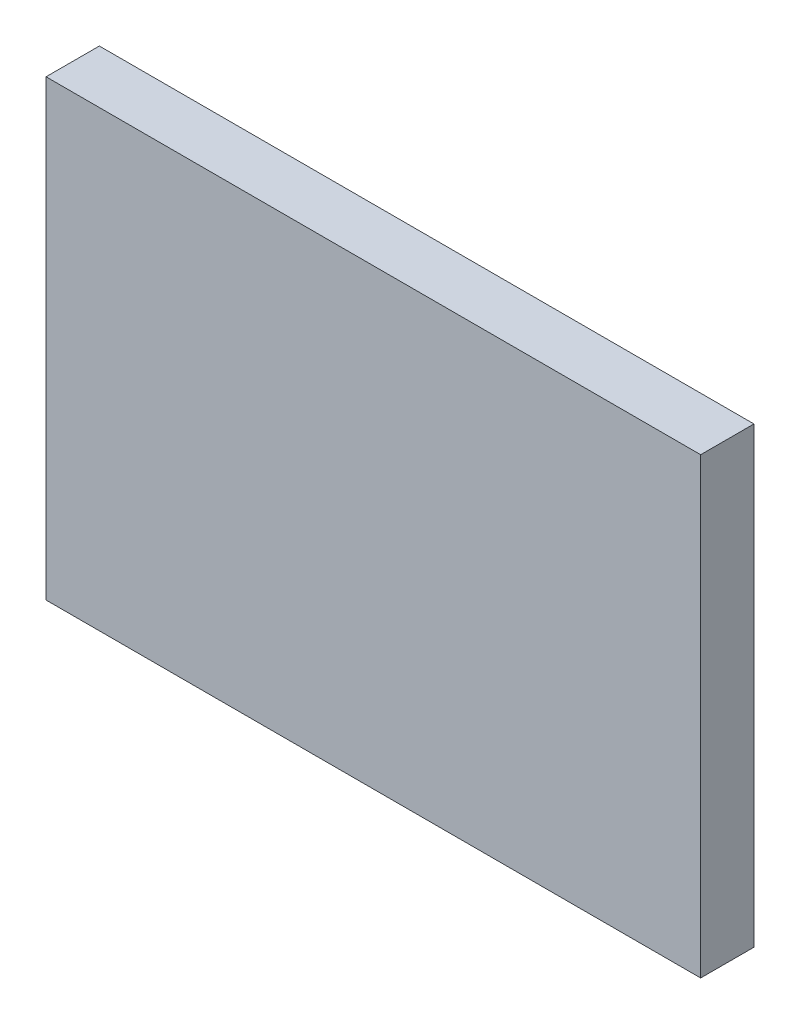
from build123d import *

# Parameters (mm, degrees)
SKETCH1_W           = 39
SKETCH1_H           = 27
BOSS_EXTRUDE1_DEPTH = 3.175


with BuildPart() as part:
    # Sketch1 → Boss-Extrude1 (new body)
    with BuildSketch(Plane.XY):
        Rectangle(SKETCH1_W, SKETCH1_H)
    extrude(amount=BOSS_EXTRUDE1_DEPTH)


solid = part.part
